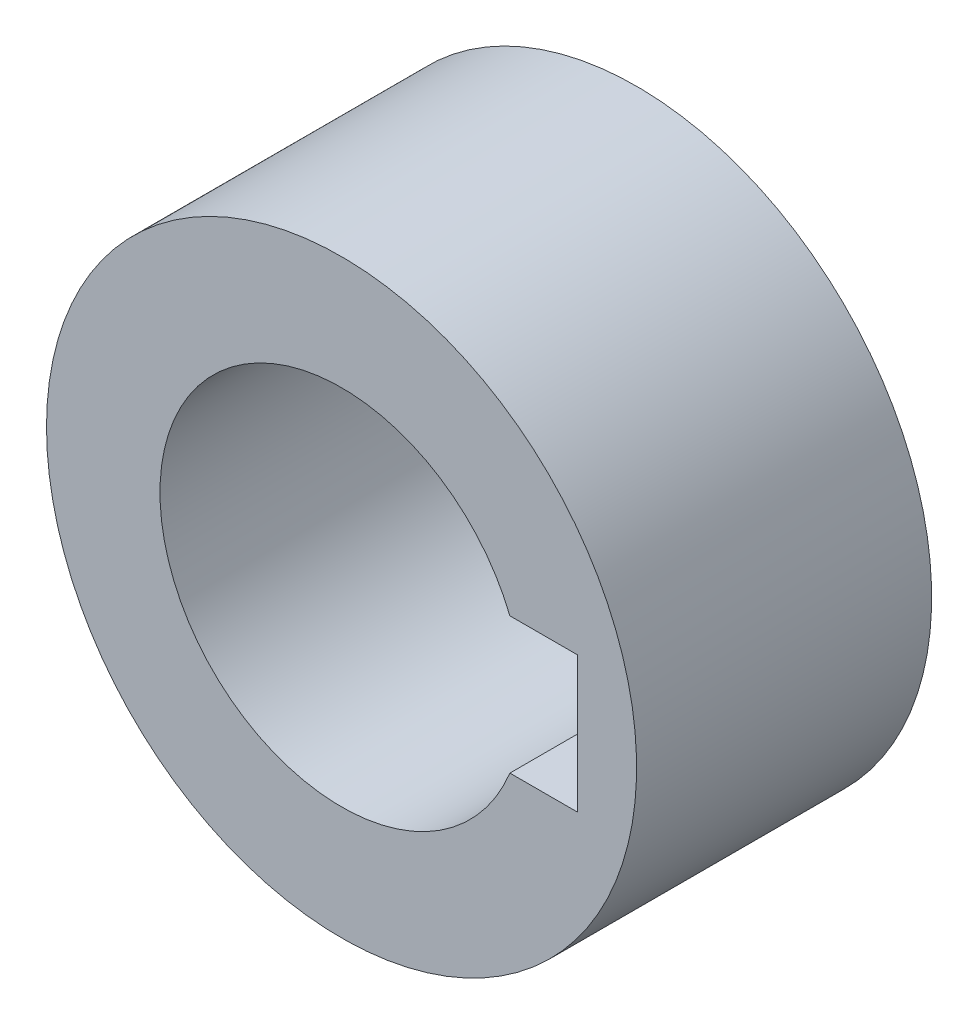
from build123d import *

# Parameters (mm, degrees)
SKETCH1_R           = 6.5
BOSS_EXTRUDE1_DEPTH = 6.5


with BuildPart() as part:
    # Sketch1 → Boss-Extrude1 (new body)
    with BuildSketch(Plane.XY):
        with Locations(Location((0, 0, 0), (0, 0, 180))):
            Circle(SKETCH1_R)
        with BuildLine():
            Line((5.2, -1.5), (3.708099244, -1.5))
            ThreePointArc((3.708099244, -1.5), (-4, 0), (3.708099244, 1.5))
            Line((3.708099244, 1.5), (5.2, 1.5))
            Line((5.2, 1.5), (5.2, -1.5))
        make_face(mode=Mode.SUBTRACT)
    extrude(amount=BOSS_EXTRUDE1_DEPTH)


solid = part.part
